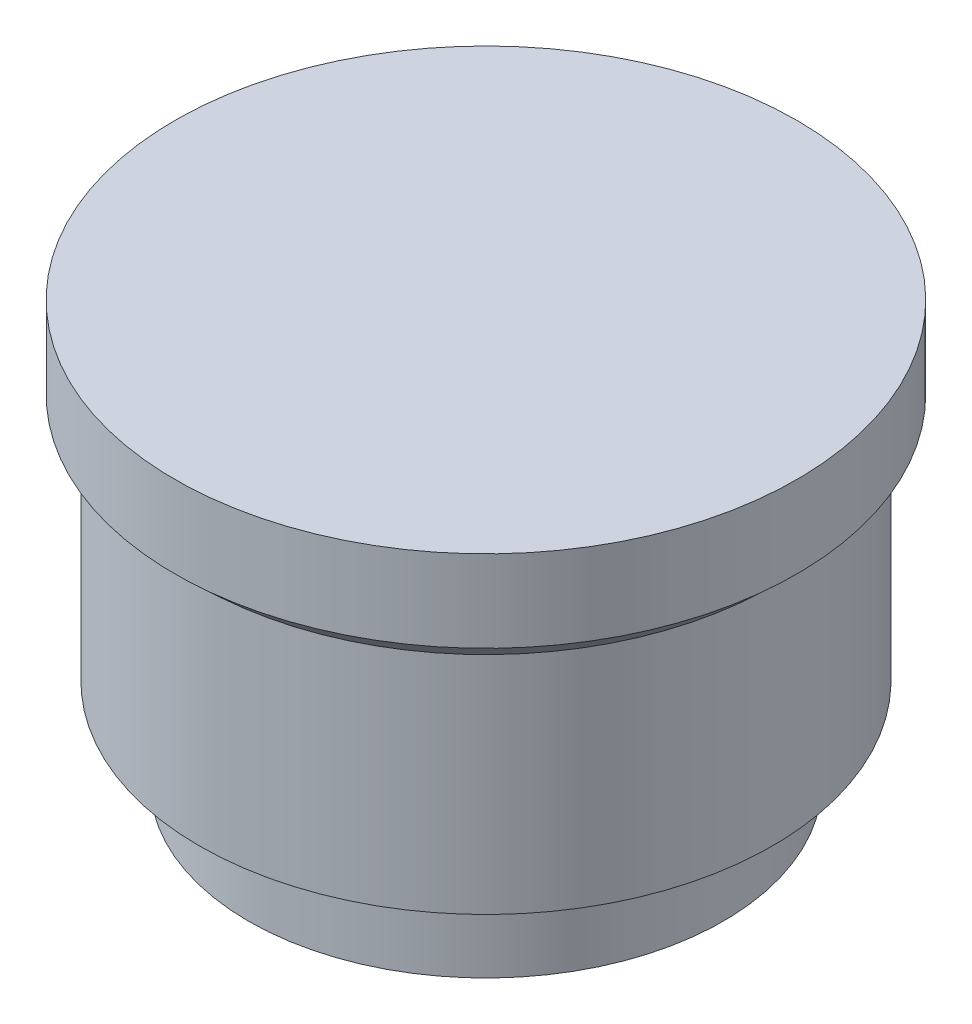
from build123d import *


with BuildPart() as part:
    # Sketch1 → Revolve1 (revolve)
    with BuildSketch(Plane.XY, mode=Mode.PRIVATE) as revolve1_sk:
        Polygon((-29, 0), (0, 0), (0, 51.25), (-38, 51.25), (-38, 41.25), (-35, 38.464101615), (-35, 10.964101615), (-29, 7.5), align=None)
    revolve(revolve1_sk.sketch.rotate(Axis((0, -13.565135504, 0), (0, 1, 0)), 270), axis=Axis((0, -13.565135504, 0), (0, 1, 0)))


solid = part.part
